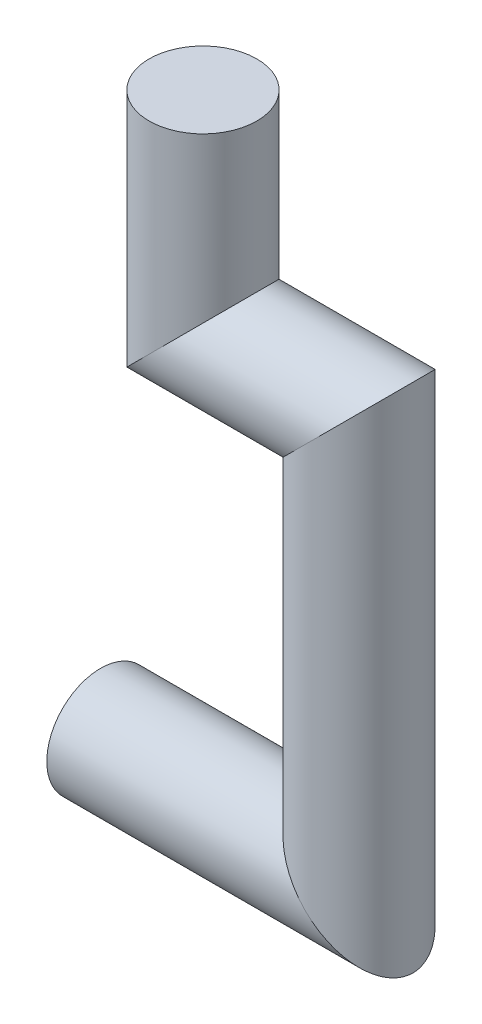
from build123d import *

# Parameters (mm, degrees)
SKETCH2_R = 20


with BuildPart() as part:
    # Sweep3: sweep along a path in Sketch1
    with BuildLine(Plane.XY) as sweep3_path:
        Line((38, 100), (38, 25))
        Line((38, 25), (96, 25))
        Line((96, 25), (96, -125))
        Line((96, -125), (0, -125))
    # Sketch2 → Sweep3 (sweep)
    with BuildSketch(Plane(origin=(0, 0, 0), x_dir=(0, 0, -1), z_dir=(1, 0, 0))):
        with Locations((0, -125)):
            Circle(SKETCH2_R)
    sweep(path=sweep3_path.line, transition=Transition.RIGHT)


solid = part.part
